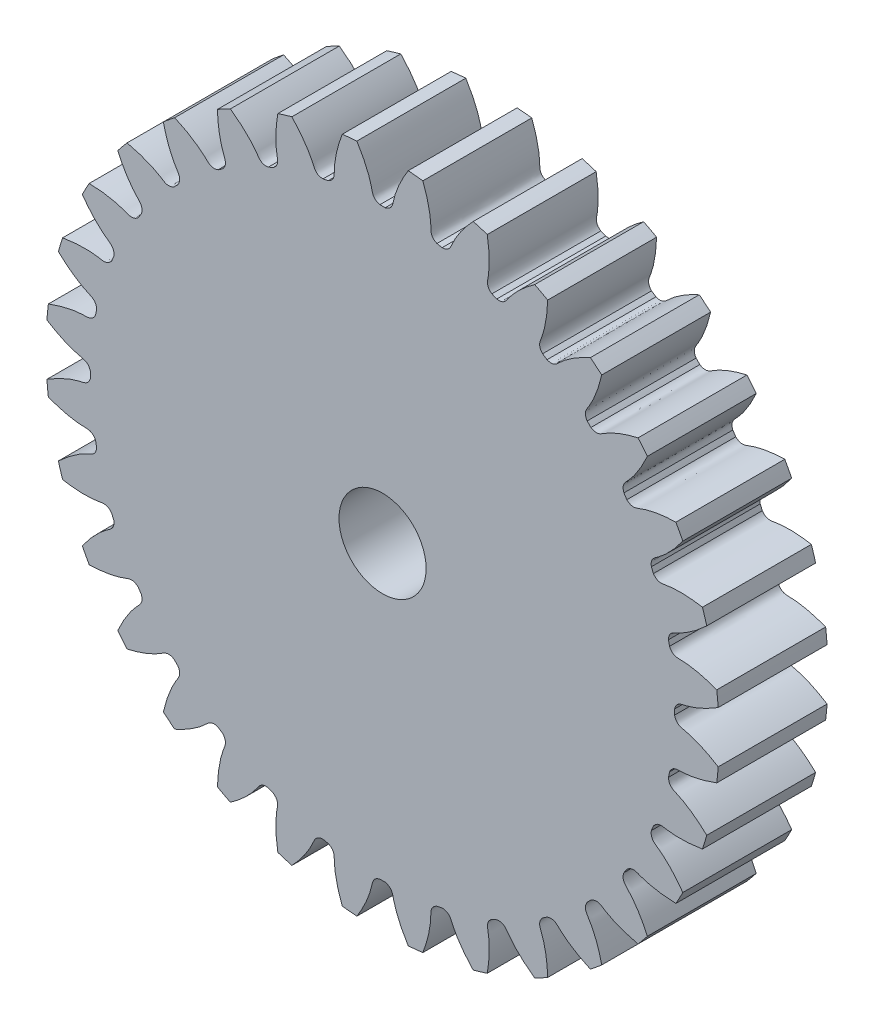
from build123d import *

# Parameters (mm, degrees)
SKETCH_1_R               = 8.5
EXTRUDE_1_DEPTH          = 2.75
CUT_EXTRUDE_1_DEPTH      = 13.331362455
PATTERN_CIRCULAR_1_COUNT = 32
CUT_EXTRUDE_2_REACH      = 14.297
SKETCH_4_R               = 1.1


with BuildPart() as part:
    # 草图1 → 凸台-拉伸1 (new body)
    with BuildSketch(Plane.XY):
        Circle(SKETCH_1_R)
    extrude(amount=EXTRUDE_1_DEPTH)

    # 草图2 → 切除-拉伸1 (cut, through all)
    with BuildSketch(Plane.XY):
        with BuildLine():
            ThreePointArc((0.067016057, 7.374695509), (0, 7.375), (-0.067016057, 7.374695509))
            add(Edge.make_bspline(
                [(-0.067016057, 7.374695509), (-0.244409752, 7.417585205), (-0.254185421, 7.546206625), (-0.286714327, 7.680381026), (-0.295183058, 7.71268082), (-0.305128683, 7.747692877), (-0.31664673, 7.785376713), (-0.32985255, 7.825680217), (-0.344853694, 7.868550436), (-0.361758143, 7.913930361), (-0.380671731, 7.961759942), (-0.401698795, 8.011975833), (-0.424941869, 8.064511528), (-0.450501667, 8.119297378), (-0.478476978, 8.176260642), (-0.508964584, 8.235325541), (-0.542059185, 8.296413305), (-0.577853311, 8.359442229), (-0.616437247, 8.424327727), (-0.657898954, 8.490982392), (-0.702323991, 8.559316051), (-0.749795443, 8.629235832), (-0.800393843, 8.700646224), (-0.854197106, 8.773449143), (-0.911280452, 8.847543999), (-0.971716342, 8.922827763), (-1.035574408, 8.999195043), (-1.102921392, 9.07653815), (-1.173821075, 9.154747175), (-1.248334222, 9.233710065), (-1.326518523, 9.313312698), (-1.40842851, 9.393438964), (-1.524138832, 9.502187768), (-1.614498649, 9.582084996), (-1.676516268, 9.63480345)],
                knots=[0, 0, 0, 0, 0.124532679, 0.135328735, 0.147193327, 0.160126453, 0.174128116, 0.189198313, 0.205337046, 0.222544314, 0.240820117, 0.260164456, 0.28057733, 0.302058739, 0.324608684, 0.348227164, 0.372914179, 0.39866973, 0.425493816, 0.453386438, 0.482347595, 0.512377287, 0.543475514, 0.575642277, 0.608877575, 0.643181408, 0.678553777, 0.714994681, 0.752504121, 0.791082096, 0.830728606, 0.871443651, 0.913227232, 1, 1, 1, 1], degree=3))
            ThreePointArc((-1.676516268, 9.63480345), (0, 9.779577922), (1.676516268, 9.63480345))
            add(Edge.make_bspline(
                [(0.067016057, 7.374695509), (0.244409752, 7.417585205), (0.254185421, 7.546206625), (0.286714327, 7.680381026), (0.295183058, 7.71268082), (0.305128683, 7.747692877), (0.31664673, 7.785376713), (0.32985255, 7.825680217), (0.344853694, 7.868550436), (0.361758143, 7.913930361), (0.380671731, 7.961759942), (0.401698795, 8.011975833), (0.424941869, 8.064511528), (0.450501667, 8.119297378), (0.478476978, 8.176260642), (0.508964584, 8.235325541), (0.542059185, 8.296413305), (0.577853311, 8.359442229), (0.616437247, 8.424327727), (0.657898954, 8.490982392), (0.702323991, 8.559316051), (0.749795443, 8.629235832), (0.800393843, 8.700646224), (0.854197106, 8.773449143), (0.911280452, 8.847543999), (0.971716342, 8.922827763), (1.035574408, 8.999195043), (1.102921392, 9.07653815), (1.173821075, 9.154747175), (1.248334222, 9.233710065), (1.326518523, 9.313312698), (1.40842851, 9.393438964), (1.524138832, 9.502187768), (1.614498649, 9.582084996), (1.676516268, 9.63480345)],
                knots=[0, 0, 0, 0, 0.124532679, 0.135328735, 0.147193327, 0.160126453, 0.174128116, 0.189198313, 0.205337046, 0.222544314, 0.240820117, 0.260164456, 0.28057733, 0.302058739, 0.324608684, 0.348227164, 0.372914179, 0.39866973, 0.425493816, 0.453386438, 0.482347595, 0.512377287, 0.543475514, 0.575642277, 0.608877575, 0.643181408, 0.678553777, 0.714994681, 0.752504121, 0.791082096, 0.830728606, 0.871443651, 0.913227232, 1, 1, 1, 1], degree=3))
        make_face()
    cut_extrude_1 = extrude(amount=CUT_EXTRUDE_1_DEPTH, mode=Mode.SUBTRACT)

    # 阵列(圆周)1: 切除-拉伸1 ×32 about axis
    pattern_circular_1_axis = Axis((0, 0, 2.75), (0, 0, -1))
    for i in range(1, PATTERN_CIRCULAR_1_COUNT):
        add(cut_extrude_1.rotate(pattern_circular_1_axis, i * 360 / PATTERN_CIRCULAR_1_COUNT), mode=Mode.SUBTRACT)

    # 草图4 → 切除-拉伸2 (cut, up to next)
    with BuildSketch(Plane(origin=(0, 0, 0), x_dir=(-1, 0, 0), z_dir=(0, 0, -1)), mode=Mode.PRIVATE) as cut_extrude_2_sk1:
        Circle(SKETCH_4_R)
    cut_extrude_2_tool1 = extrude(cut_extrude_2_sk1.sketch, amount=-CUT_EXTRUDE_2_REACH, mode=Mode.PRIVATE) & part.part
    add(cut_extrude_2_tool1.solids().sort_by_distance((0, 0, 0))[0], mode=Mode.SUBTRACT)


solid = part.part
